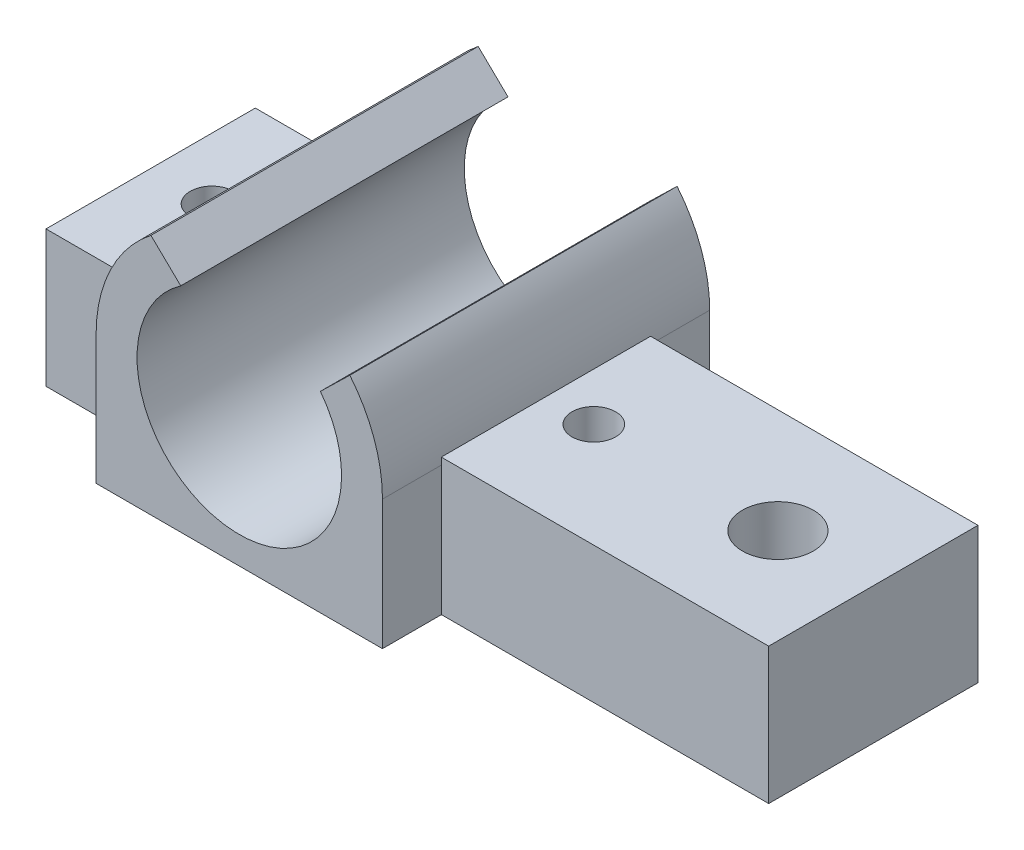
from build123d import *

# Parameters (mm, degrees)
SKETCH1_W                = 53
SKETCH1_H                = 15.35
SKETCH1_R                = 1.6
SKETCH1_R_2              = 2.6
BOSS_EXTRUDE1_DEPTH      = 10
BOSS_EXTRUDE2_DEPTH      = 4.325
BOSS_EXTRUDE2_DEPTH_BACK = 19.675
CUT_EXTRUDE1_DEPTH       = 79.033367864
CUT_EXTRUDE2_DEPTH       = 4
SKETCH5_R                = 2.6
BOSS_EXTRUDE3_DEPTH      = 0.4


with BuildPart() as part:
    # Sketch1 → Boss-Extrude1 (new body)
    with BuildSketch(Plane(origin=(0, 0, 0), x_dir=(1, 0, 0), z_dir=(0, 1, 0))):
        with Locations((46.893734614, 0)):
            Rectangle(SKETCH1_W, SKETCH1_H)
        with Locations(Location((52.893734614, 0, 0), (0, 0, 270))):
            Circle(SKETCH1_R, mode=Mode.SUBTRACT)
        with Locations(Location((24.893734614, 0, 0), (0, 0, 270))):
            Circle(SKETCH1_R, mode=Mode.SUBTRACT)
        with Locations(Location((66.393734614, 0, 0), (0, 0, 270))):
            Circle(SKETCH1_R_2, mode=Mode.SUBTRACT)
    extrude(amount=BOSS_EXTRUDE1_DEPTH)

    # Sketch2 → Boss-Extrude2 (add, two sides: drawn at the far end of the back side and taken through both)
    with BuildSketch(Plane(origin=(0, 0, -7.675), x_dir=(-1, 0, 0), z_dir=(0, 0, -1)).offset(-BOSS_EXTRUDE2_DEPTH_BACK)):
        with BuildLine():
            Line((-44.841298991, 14.069078461), (-47.002272565, 16.170952878))
            ThreePointArc((-47.002272565, 16.170952878), (-48.777803829, 13.043328345), (-49.393734614, 9.5))
            Line((-49.393734614, 9.5), (-49.393734614, 0))
            Line((-49.393734614, 0), (-28.393734614, 0))
            Line((-28.393734614, 0), (-28.393734614, 9.5))
            ThreePointArc((-28.393734614, 9.5), (-29.451814157, 14.09348866), (-32.412808532, 17.761210391))
            Line((-32.412808532, 17.761210391), (-34.599781066, 15.649143267))
            ThreePointArc((-34.599781066, 15.649143267), (-37.750161971, 2.087696606), (-44.841298991, 14.069078461))
        make_face()
    extrude(amount=BOSS_EXTRUDE2_DEPTH + BOSS_EXTRUDE2_DEPTH_BACK)

    # Sketch3 → Cut-Extrude1 (cut, through all)
    with BuildSketch(Plane.XY.offset(7.675)):
        with BuildLine():
            Line((46.377049388, 10), (31.410419841, 10))
            ThreePointArc((31.410419841, 10), (38.893734614, 2), (46.377049388, 10))
        make_face()
    extrude(amount=-CUT_EXTRUDE1_DEPTH, mode=Mode.SUBTRACT)

    # Sketch4 → Cut-Extrude2 (cut)
    with BuildSketch(Plane.XZ):
        Polygon((62.410017757, 2.3), (62.410017757, -2.3), (66.393734614, -4.6), (70.377451472, -2.3), (70.377451472, 2.3), (66.393734614, 4.6), align=None)
    extrude(amount=-CUT_EXTRUDE2_DEPTH, mode=Mode.SUBTRACT)

    # Sketch5 → Boss-Extrude3 (add)
    with BuildSketch(Plane.XZ.offset(-4)):
        with Locations(Location((66.393734614, 0, 0), (0, 0, 270))):
            Circle(SKETCH5_R)
    extrude(amount=-BOSS_EXTRUDE3_DEPTH)


solid = part.part
